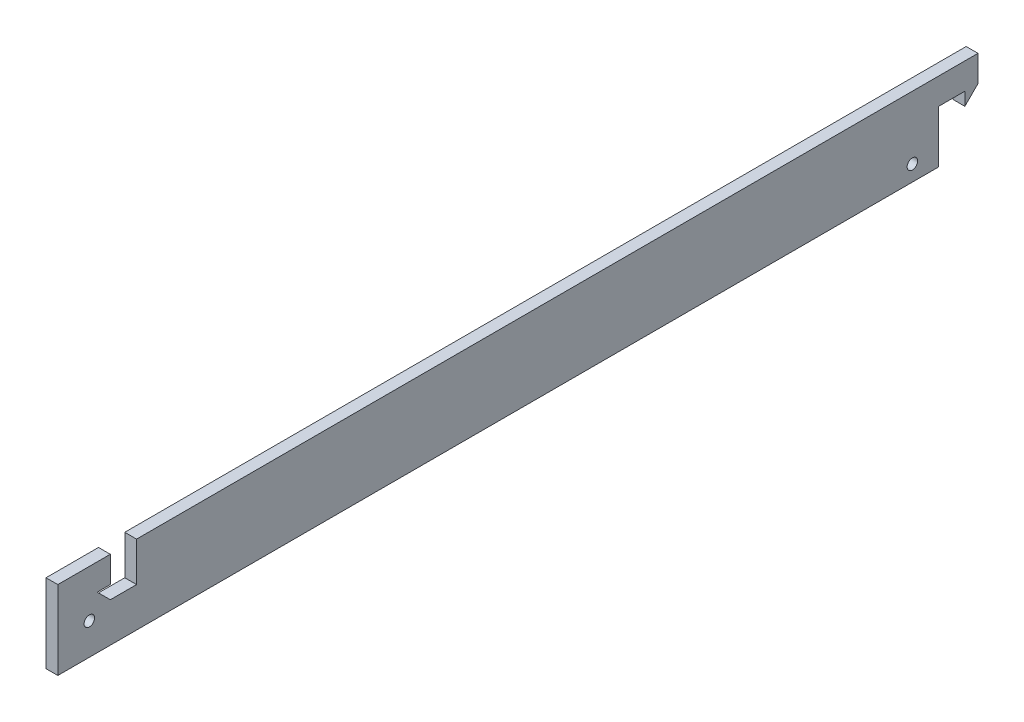
from build123d import *

# Parameters (mm, degrees)
SKETCH1_R           = 2
BOSS_EXTRUDE1_DEPTH = 4.5


with BuildPart() as part:
    # Sketch1 → Boss-Extrude1 (new body)
    with BuildSketch(Plane(origin=(0, 0, 0), x_dir=(0, 0, -1), z_dir=(1, 0, 0))):
        Polygon((-30.84603871, 0), (-40.84603871, 0), (-45.84603871, 5), (-40.84603871, 5), (-40.84603871, 15), (-60.84603871, 15), (-60.84603871, -15), (274.65396129, -15), (274.65396129, 5), (284.65396129, 5), (284.65396129, 0), (289.65396129, 5), (289.65396129, 15), (274.65396129, 15), (-30.84603871, 15), align=None)
        with Locations((-48.84603871, -3)):
            Circle(SKETCH1_R, mode=Mode.SUBTRACT)
        with Locations((264.65396129, -9)):
            Circle(SKETCH1_R, mode=Mode.SUBTRACT)
    extrude(amount=BOSS_EXTRUDE1_DEPTH)


solid = part.part
